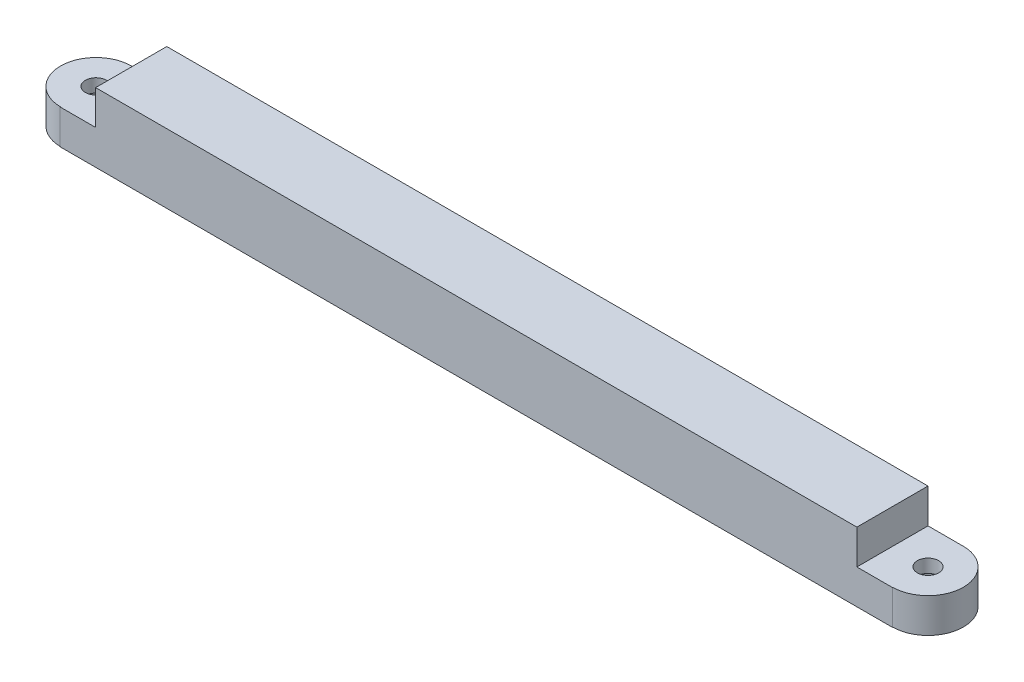
from build123d import *

# Parameters (mm, degrees)
BOSS_EXTRUDE1_DEPTH = 9.75
CUT_EXTRUDE3_START  = -4.875
CUT_EXTRUDE3_DEPTH  = 4.875
SKETCH3_R           = 2.825
CUT_EXTRUDE4_DEPTH  = 3


with BuildPart() as part:
    # Sketch1 → Boss-Extrude1 (new body)
    with BuildSketch(Plane(origin=(0, 0, 0), x_dir=(1, 0, 0), z_dir=(0, 1, 0))):
        with BuildLine():
            Line((0, 5), (0, 0))
            Line((0, 0), (53.75, 0))
            ThreePointArc((53.75, 0), (55.214466094, 3.535533906), (58.75, 5))
            Line((58.75, 5), (0, 5))
        make_face()
        with BuildLine():
            Line((53.75, 0), (0, 0))
            Line((0, 0), (0, -5.049027621))
            Line((0, -5.049027621), (58.75, -5.049027621))
            Line((58.75, -5.049027621), (58.75, -5))
            ThreePointArc((58.75, -5), (55.214466094, -3.535533906), (53.75, 0))
        make_face()
        with BuildLine():
            ThreePointArc((63.75, 0), (62.285533906, 3.535533906), (58.75, 5))
            Line((58.75, 5), (58.75, 1.5))
            ThreePointArc((58.75, 1.5), (59.810660172, 1.060660172), (60.25, 0))
            ThreePointArc((60.25, 0), (59.810660172, -1.060660172), (58.75, -1.5))
            Line((58.75, -1.5), (58.75, -5))
            ThreePointArc((58.75, -5), (62.285533906, -3.535533906), (63.75, 0))
        make_face()
        with BuildLine():
            ThreePointArc((58.75, 5), (55.214466094, 3.535533906), (53.75, 0))
            Line((53.75, 0), (57.25, 0))
            ThreePointArc((57.25, 0), (57.689339828, 1.060660172), (58.75, 1.5))
            Line((58.75, 1.5), (58.75, 5))
        make_face()
        with BuildLine():
            Line((57.25, 0), (53.75, 0))
            ThreePointArc((53.75, 0), (55.214466094, -3.535533906), (58.75, -5))
            Line((58.75, -5), (58.75, -1.5))
            ThreePointArc((58.75, -1.5), (57.689339828, -1.060660172), (57.25, 0))
        make_face()
    boss_extrude1 = extrude(amount=BOSS_EXTRUDE1_DEPTH)

    # Mirror1: Boss-Extrude1 across plane
    add(boss_extrude1.mirror(Plane(origin=(0, 0, 0), x_dir=(0, 0, 1), z_dir=(1, 0, 0))))

    # Sketch2 → Cut-Extrude3 (cut)
    with BuildSketch(Plane(origin=(0, 9.75, 0), x_dir=(1, 0, 0), z_dir=(0, 1, 0)).offset(CUT_EXTRUDE3_START)):
        with BuildLine():
            Line((60.25, 0), (63.75, 0))
            ThreePointArc((63.75, 0), (62.285533906, 3.535533906), (58.75, 5))
            Line((58.75, 5), (53.75, 5))
            Line((53.75, 5), (53.75, 0))
            Line((53.75, 0), (57.25, 0))
            ThreePointArc((57.25, 0), (58.75, 1.5), (60.25, 0))
        make_face()
        with BuildLine():
            ThreePointArc((58.75, -5), (62.285533906, -3.535533906), (63.75, 0))
            Line((63.75, 0), (60.25, 0))
            ThreePointArc((60.25, 0), (58.75, -1.5), (57.25, 0))
            Line((57.25, 0), (53.75, 0))
            Line((53.75, 0), (53.75, -5.049027621))
            Line((53.75, -5.049027621), (58.75, -5.049027621))
            Line((58.75, -5.049027621), (58.75, -5))
        make_face()
    cut_extrude3 = extrude(amount=CUT_EXTRUDE3_DEPTH, mode=Mode.SUBTRACT)

    # Mirror2: Cut-Extrude3 across plane
    add(cut_extrude3.mirror(Plane(origin=(0, 0, 0), x_dir=(0, 0, 1), z_dir=(1, 0, 0))), mode=Mode.SUBTRACT)

    # Sketch3 → Cut-Extrude4 (cut)
    with BuildSketch(Plane(origin=(0, 0, 0), x_dir=(-1, 0, 0), z_dir=(0, -1, 0))):
        with Locations(Location((58.75, 0, 0), (0, 0, 90))):
            Circle(SKETCH3_R)
        with Locations(Location((-58.75, 0, 0), (0, 0, 90))):
            Circle(SKETCH3_R)
    extrude(amount=-CUT_EXTRUDE4_DEPTH, mode=Mode.SUBTRACT)


solid = part.part
